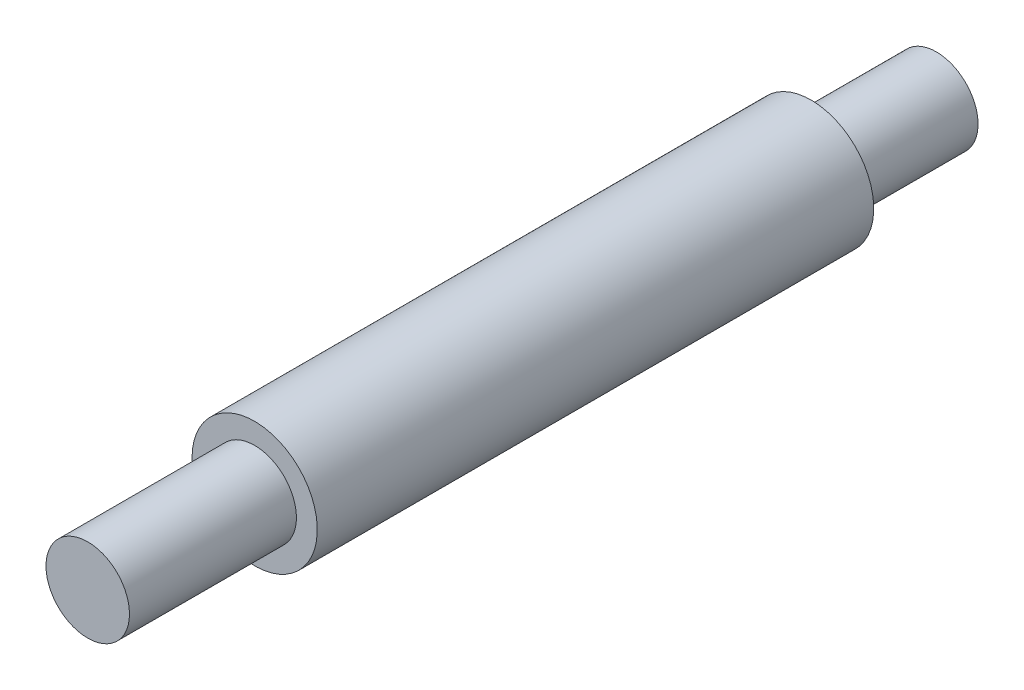
from build123d import *

# Parameters (mm, degrees)
SKETCH1_R           = 1.5
BOSS_EXTRUDE1_DEPTH = 6
SKETCH2_R           = 2.25
BOSS_EXTRUDE2_DEPTH = 20
BOSS_EXTRUDE3_START = 4.5
SKETCH3_R           = 1.5
BOSS_EXTRUDE3_DEPTH = 4.5


with BuildPart() as part:
    # Sketch1 → Boss-Extrude1 (new body)
    with BuildSketch(Plane.XY):
        Circle(SKETCH1_R)
    extrude(amount=BOSS_EXTRUDE1_DEPTH)

    # Sketch2 → Boss-Extrude2 (add)
    with BuildSketch(Plane(origin=(0, 0, 0), x_dir=(-1, 0, 0), z_dir=(0, 0, -1))):
        Circle(SKETCH2_R)
    extrude(amount=BOSS_EXTRUDE2_DEPTH)

    # Sketch3 → Boss-Extrude3 (add)
    with BuildSketch(Plane(origin=(0, 0, -20), x_dir=(-1, 0, 0), z_dir=(0, 0, -1)).offset(BOSS_EXTRUDE3_START)):
        Circle(SKETCH3_R)
    extrude(amount=-BOSS_EXTRUDE3_DEPTH)


solid = part.part
